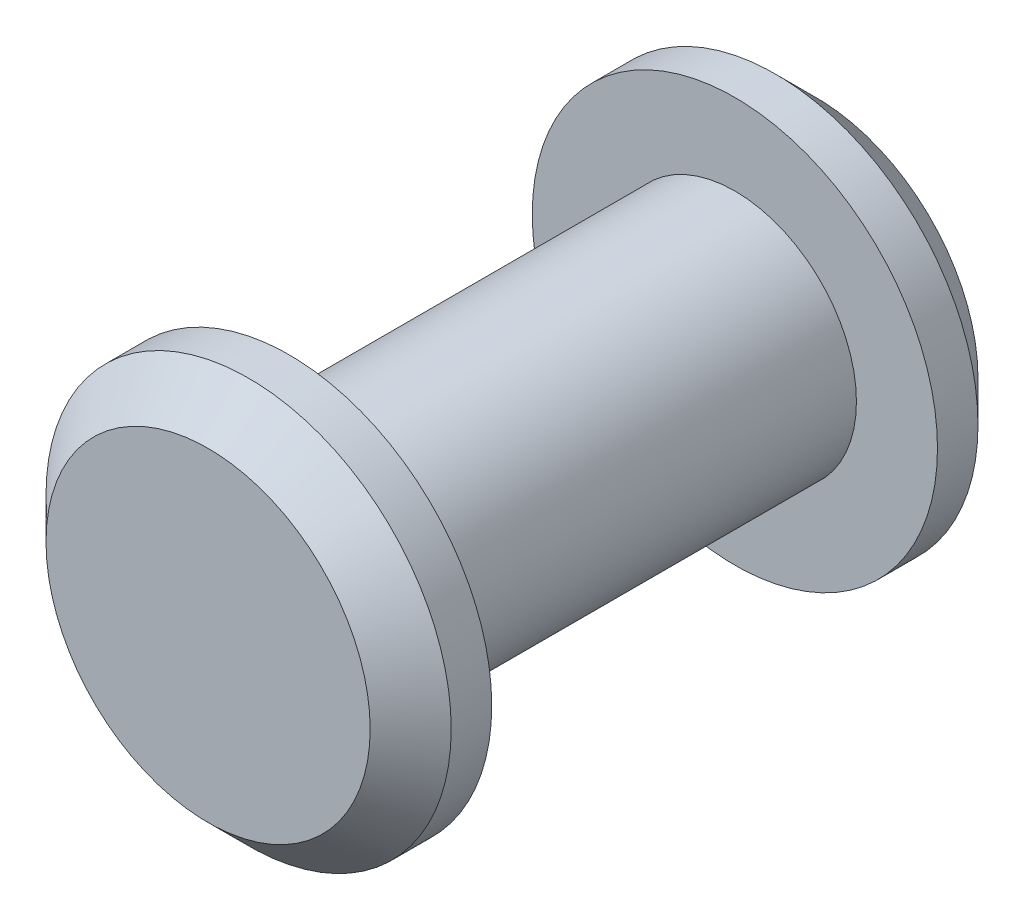
from build123d import *


with BuildPart() as part:
    # Sketch1 → Revolve1 (revolve)
    with BuildSketch(Plane(origin=(0, 0, 0), x_dir=(1, 0, 0), z_dir=(0, 1, 0))):
        Polygon((0, 15), (8, 15), (10, 13), (10, 11), (6, 11), (6, -11), (10, -11), (10, -13), (8, -15), (0, -15), align=None)
    revolve(axis=Axis((0, 0, 15), (0, 0, -1)))


solid = part.part
